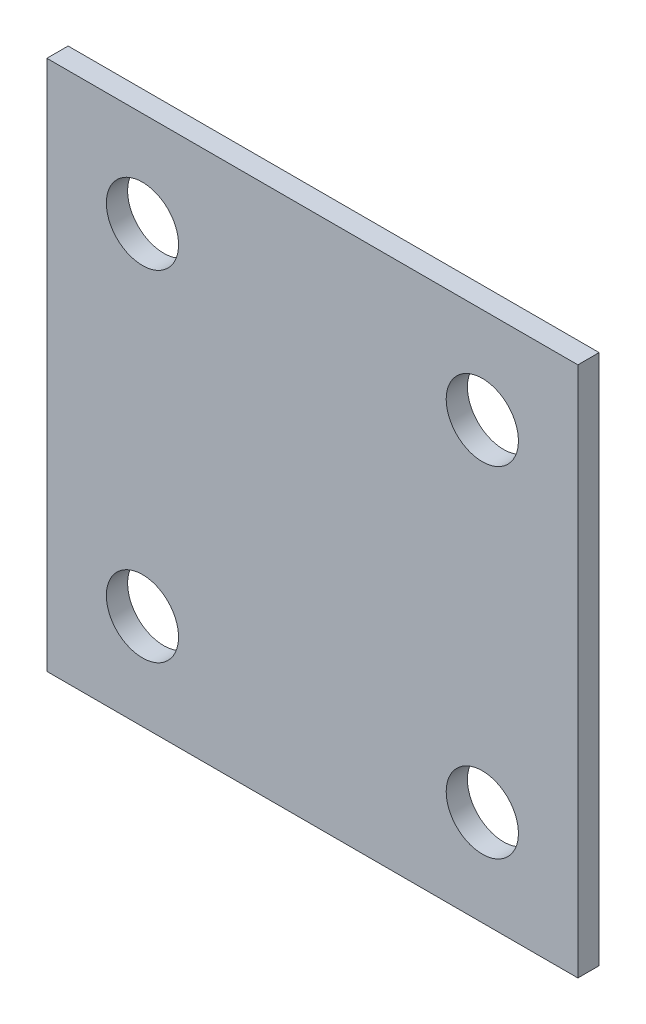
from build123d import *

# Parameters (mm, degrees)
ESQUISSE1_W        = 25
ESQUISSE1_H        = 25
BOSS_EXTRU_1_DEPTH = 1
D_GAGEMENT_M31_D   = 3.4


with BuildPart() as part:
    # Esquisse1 → Boss.-Extru.1 (new body)
    with BuildSketch(Plane.XY):
        Rectangle(ESQUISSE1_W, ESQUISSE1_H)
    extrude(amount=BOSS_EXTRU_1_DEPTH)

    # Dégagement M31 (through all)
    with Locations(Plane(origin=(0, 0, 0), x_dir=(-1, 0, 0), z_dir=(0, 0, -1))):
        with Locations((8, -8), (8, 8), (-8, 8), (-8, -8)):
            Hole(D_GAGEMENT_M31_D / 2)


solid = part.part
